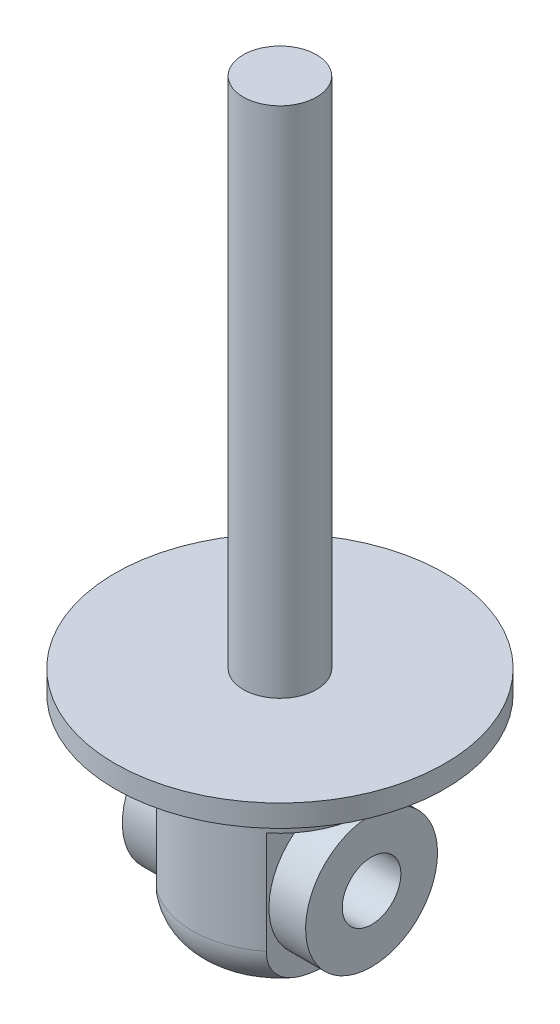
from build123d import *
from build123d.topology import SkipClean

# Parameters (mm, degrees)
ESBO_O1_R                = 22.5
RESSALTO_EXTRUS_O1_DEPTH = 3
ESBO_O2_R                = 5
RESSALTO_EXTRUS_O2_DEPTH = 70
ESBO_O3_R                = 12
RESSALTO_EXTRUS_O3_DEPTH = 28
FILETE1_R                = 6
ESBO_O4_W                = 23.252293475
ESBO_O4_H                = 20
CORTE_EXTRUS_O1_DEPTH    = 14
ESBO_O5_R                = 4
CORTE_EXTRUS_O3_DEPTH    = 28
ESBO_O7_R                = 9
ESBO_O7_R_2              = 4
RESSALTO_EXTRUS_O4_DEPTH = 12.5


with BuildPart() as part:
    # Esboço1 → Ressalto-extrusão1 (new body)
    with BuildSketch(Plane(origin=(0, 0, 0), x_dir=(1, 0, 0), z_dir=(0, 1, 0))):
        with Locations(Location((0, 0, 0), (0, 0, 270))):
            Circle(ESBO_O1_R)
    extrude(amount=RESSALTO_EXTRUS_O1_DEPTH)

    # Esboço2 → Ressalto-extrusão2 (add)
    with BuildSketch(Plane(origin=(0, 3, 0), x_dir=(1, 0, 0), z_dir=(0, 1, 0))):
        with Locations(Location((0, 0, 0), (0, 0, 270))):
            Circle(ESBO_O2_R)
    extrude(amount=RESSALTO_EXTRUS_O2_DEPTH)

    # Esboço3 → Ressalto-extrusão3 (add)
    with BuildSketch(Plane.XZ):
        with Locations(Location((0, 0, 0), (0, 0, 90))):
            Circle(ESBO_O3_R)
    extrude(amount=RESSALTO_EXTRUS_O3_DEPTH)

    # Filete1
    filete1_edges = [part.edges().sort_by_distance(p)[0] for p in [
        (0, -28, -12),
    ]]
    fillet(filete1_edges, radius=FILETE1_R)

    # Esboço4 → Corte-extrusão1 (cut, symmetric)
    with BuildSketch(Plane.XY):
        with Locations((19.126146738, -18)):
            Rectangle(ESBO_O4_W, ESBO_O4_H)
        with Locations((-19.126146738, -18)):
            Rectangle(ESBO_O4_W, ESBO_O4_H)
    extrude(amount=CORTE_EXTRUS_O1_DEPTH, both=True, mode=Mode.SUBTRACT)

    # Esboço5 → Corte-extrusão3 (cut)
    with BuildSketch(Plane(origin=(7.5, 0, 0), x_dir=(0, 0, -1), z_dir=(1, 0, 0))):
        with Locations(Location((0, -17.022669539, 0), (0, 0, 90))):
            Circle(ESBO_O5_R)
    extrude(amount=-CORTE_EXTRUS_O3_DEPTH, mode=Mode.SUBTRACT)

    # Esboço7 → Ressalto-extrusão4 (add, symmetric)
    with SkipClean():  # the faces are left unmerged after this step: merging them gives an invalid solid
        with BuildSketch(Plane(origin=(0, 0, 0), x_dir=(0, 0, -1), z_dir=(1, 0, 0))):
            with Locations(Location((0, -17.022669539, 0), (0, 0, 270))):
                Circle(ESBO_O7_R)
            with Locations((0, -17.022669539)):
                Circle(ESBO_O7_R_2, mode=Mode.SUBTRACT)
        extrude(amount=RESSALTO_EXTRUS_O4_DEPTH, both=True)


solid = part.part
